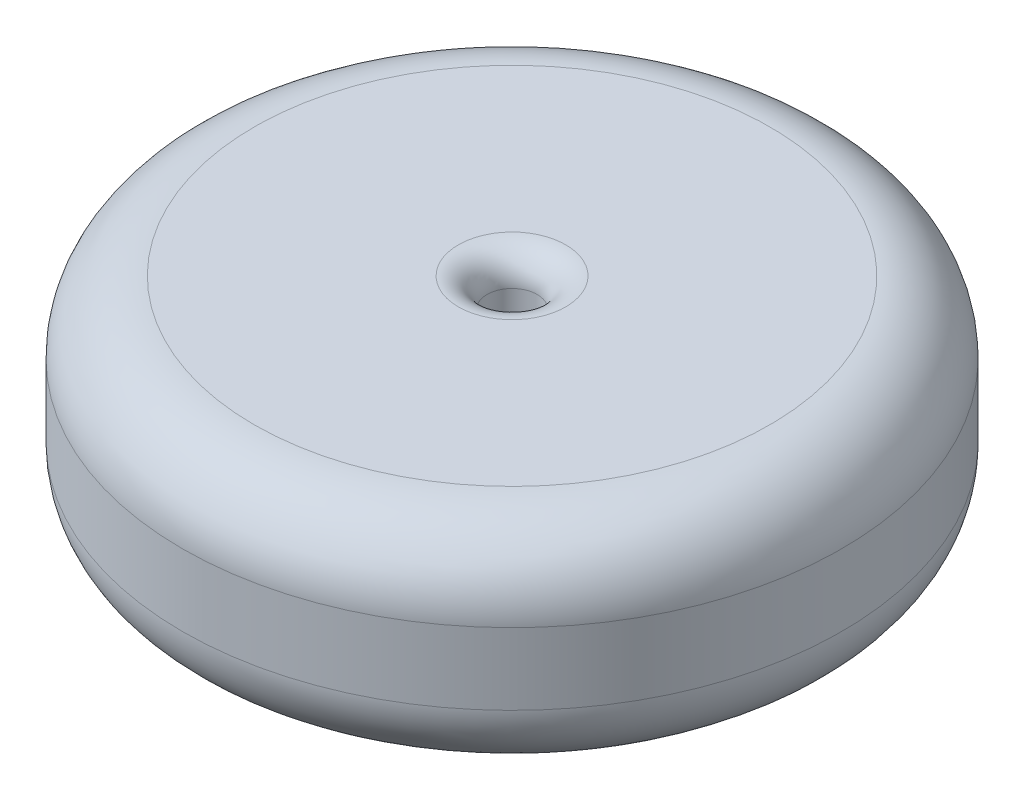
from build123d import *

# Parameters (mm, degrees)
SKETCH1_R           = 23
SKETCH1_R_2         = 1.75
BOSS_EXTRUDE1_DEPTH = 15
FILLET1_R           = 2
FILLET2_R           = 5


with BuildPart() as part:
    # Sketch1 → Boss-Extrude1 (new body)
    with BuildSketch(Plane(origin=(0, 0, 0), x_dir=(1, 0, 0), z_dir=(0, 1, 0))):
        with Locations(Location((0, 0, 0), (0, 0, 270))):
            Circle(SKETCH1_R)
        with Locations(Location((0, 0, 0), (0, 0, 270))):
            Circle(SKETCH1_R_2, mode=Mode.SUBTRACT)
    extrude(amount=BOSS_EXTRUDE1_DEPTH)

    # Fillet1
    fillet1_edges = [part.edges().sort_by_distance(p)[0] for p in [
        (0, 0, -1.75),
        (0, 15, -1.75),
    ]]
    fillet(fillet1_edges, radius=FILLET1_R)

    # Fillet2
    fillet2_edges = [part.edges().sort_by_distance(p)[0] for p in [
        (0, 0, -23),
        (0, 15, -23),
    ]]
    fillet(fillet2_edges, radius=FILLET2_R)


solid = part.part
